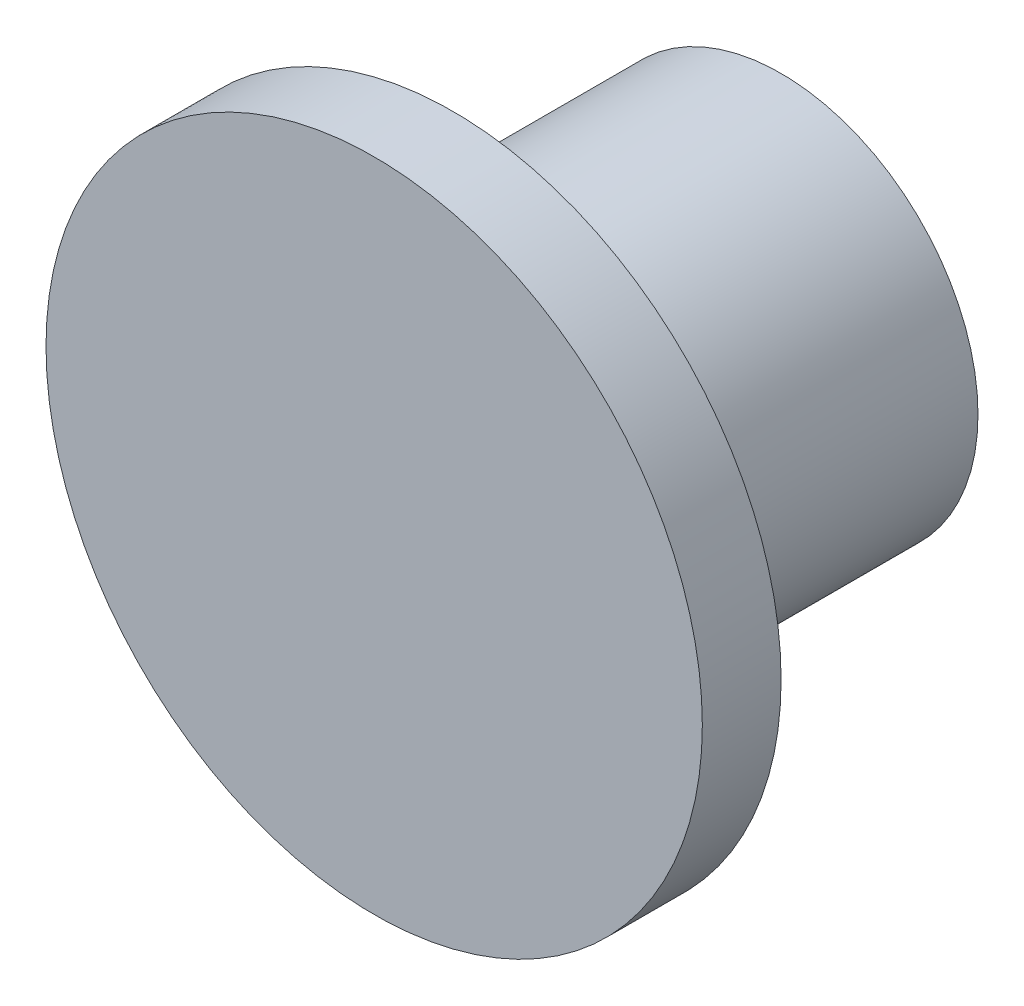
from build123d import *

# Parameters (mm, degrees)
SKETCH1_R           = 19.05
BOSS_EXTRUDE1_DEPTH = 31.75
SKETCH2_R           = 31.75
BOSS_EXTRUDE2_DEPTH = 7.62


with BuildPart() as part:
    # Sketch1 → Boss-Extrude1 (new body)
    with BuildSketch(Plane.XY):
        Circle(SKETCH1_R)
    extrude(amount=BOSS_EXTRUDE1_DEPTH)

    # Sketch2 → Boss-Extrude2 (add)
    with BuildSketch(Plane.XY.offset(31.75)):
        with Locations(Location((0, 0, 0), (0, 0, 180))):
            Circle(SKETCH2_R)
    extrude(amount=BOSS_EXTRUDE2_DEPTH)


solid = part.part
